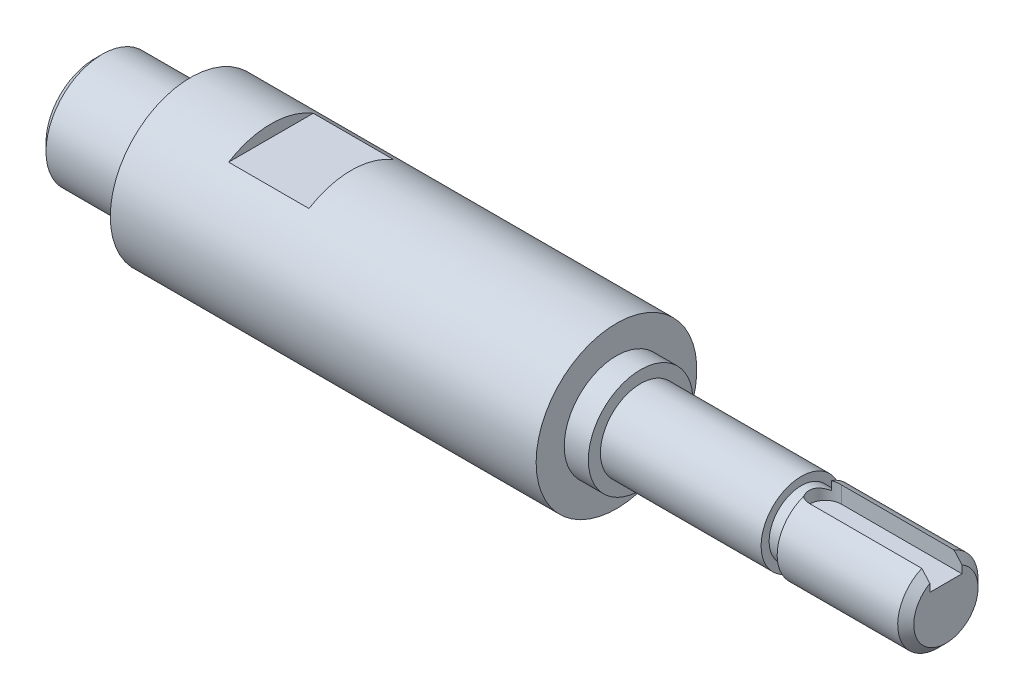
from build123d import *

# Parameters (mm, degrees)
CHAMFER_1_SIZE      = 1
SKETCH_2_W          = 10
SKETCH_2_H          = 3.47339454
SKETCH_2_H_2        = 3.228485256
CUT_EXTRUDE_1_DEPTH = 15
CUT_EXTRUDE_2_DEPTH = 2.5


with BuildPart() as part:
    # 草图1 → 旋转1 (revolve)
    with BuildSketch(Plane.XY, mode=Mode.PRIVATE) as revolve_1_sk:
        Polygon((-42.524834638, 0), (-42.524834638, 7), (-32.524834638, 7), (-32.524834638, 6), (-30.524834638, 6), (-30.524834638, 10), (22.475165362, 10), (22.475165362, 6.5), (25.475165362, 6.5), (25.475165362, 5), (45.475165362, 5), (45.475165362, 4), (47.475165362, 4), (47.475165362, 5), (63.475165362, 5), (63.475165362, 0), align=None)
    revolve(revolve_1_sk.sketch.rotate(Axis((-49.06711689, 0, 0), (1, 0, 0)), 90), axis=Axis((-49.06711689, 0, 0), (1, 0, 0)))

    # 倒角1
    chamfer_1_edges = [part.edges().sort_by_distance(p)[0] for p in [
        (63.475165362, 0, -5),
        (-42.524834638, 0, -7),
    ]]
    chamfer(chamfer_1_edges, length=CHAMFER_1_SIZE)

    # 草图2 → 拉伸1 (cut, symmetric)
    with BuildSketch(Plane.XY):
        with Locations((-15.524834638, 10.23669727)):
            Rectangle(SKETCH_2_W, SKETCH_2_H)
        with Locations((-15.524834638, -10.114242628)):
            Rectangle(SKETCH_2_W, SKETCH_2_H_2)
    extrude(amount=CUT_EXTRUDE_1_DEPTH, both=True, mode=Mode.SUBTRACT)

    # 草图3 → 拉伸2 (cut)
    with BuildSketch(Plane(origin=(0, 5, 0), x_dir=(-1, 0, 0), z_dir=(0, 1, 0))):
        with BuildLine():
            Line((-48.475165362, 2), (-63.475165362, 2))
            Line((-63.475165362, 2), (-63.475165362, -2))
            Line((-63.475165362, -2), (-48.475165362, -2))
            ThreePointArc((-48.475165362, -2), (-46.475165362, 0), (-48.475165362, 2))
        make_face()
    extrude(amount=-CUT_EXTRUDE_2_DEPTH, mode=Mode.SUBTRACT)


solid = part.part
